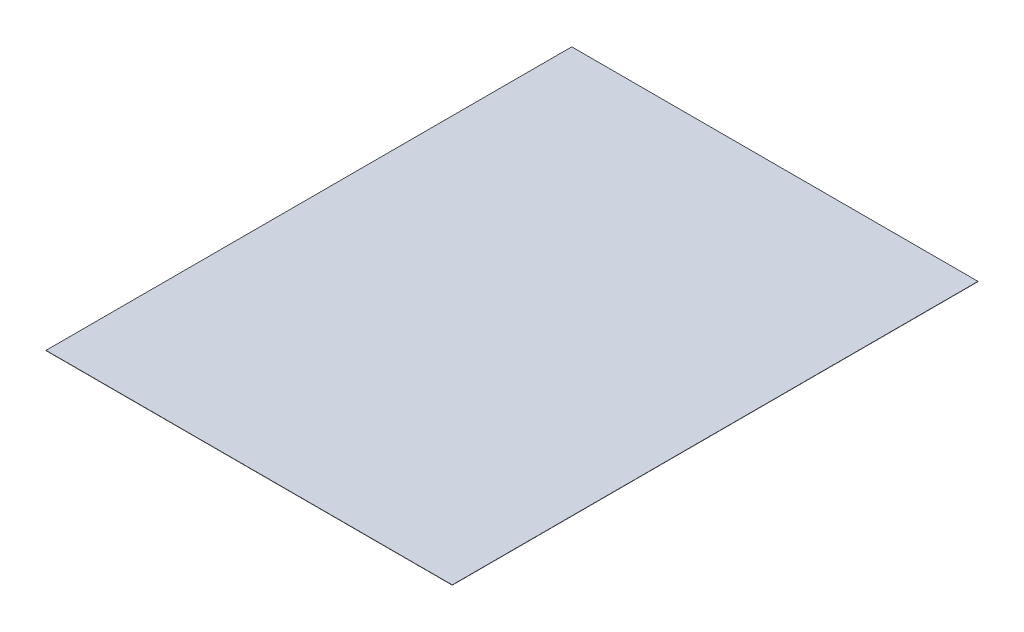
from build123d import *

# Parameters (mm, degrees)
SKETCH1_W           = 215.9
SKETCH1_H           = 279.4
BOSS_EXTRUDE1_DEPTH = 0.127


with BuildPart() as part:
    # Sketch1 → Boss-Extrude1 (new body)
    with BuildSketch(Plane(origin=(0, 0, 0), x_dir=(1, 0, 0), z_dir=(0, 1, 0))):
        with Locations((107.95, 139.7)):
            Rectangle(SKETCH1_W, SKETCH1_H)
    extrude(amount=BOSS_EXTRUDE1_DEPTH)


solid = part.part
